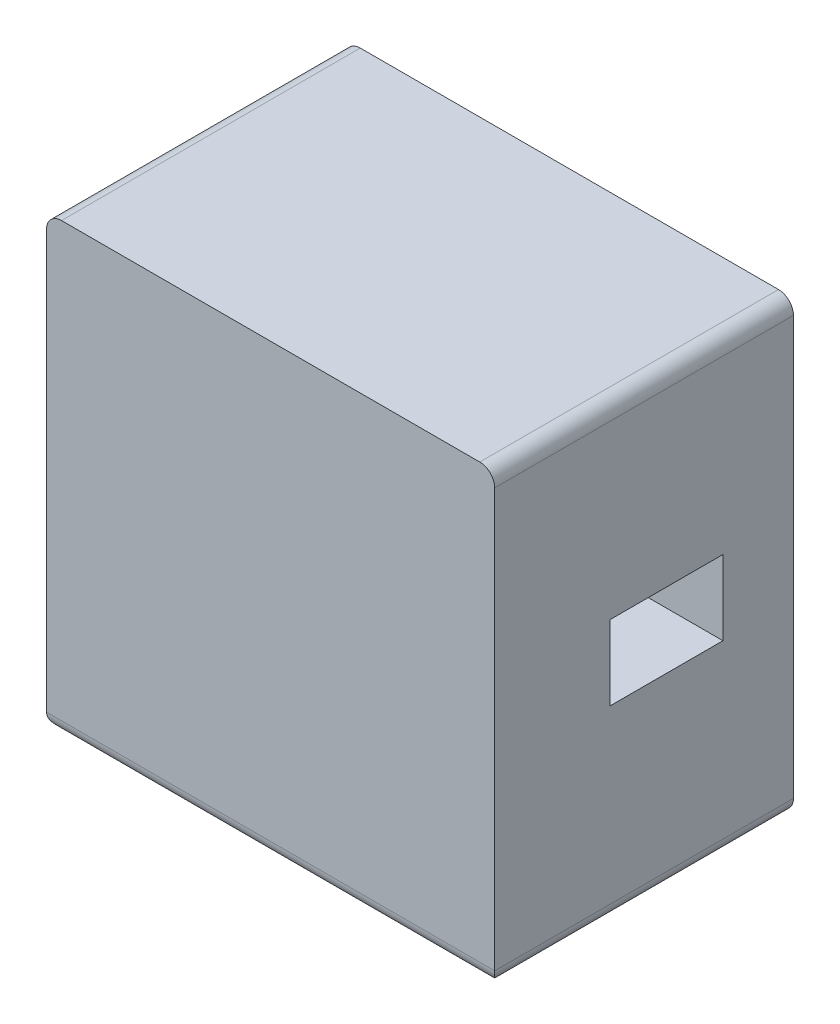
from build123d import *

# Parameters (mm, degrees)
SKETCH_1_W          = 300
SKETCH_1_H          = 300
EXTRUDE_3_DEPTH     = 200
SKETCH_5_R          = 32.35
CUT_EXTRUDE_3_DEPTH = 62
SKETCH_6_R          = 38.24
CUT_EXTRUDE_4_DEPTH = 23.7
CUT_EXTRUDE_5_REACH = 392.512
SKETCH_8_W          = 75.602160899
SKETCH_8_H          = 50
SKETCH_10_R         = 1.35
CUT_EXTRUDE_7_DEPTH = 5
FILLET_1_R          = 10


with BuildPart() as part:
    # 草图1 → 凸台-拉伸3 (new body)
    with BuildSketch(Plane.XY):
        Rectangle(SKETCH_1_W, SKETCH_1_H)
    extrude(amount=EXTRUDE_3_DEPTH)

    # 草图5 → 切除-拉伸3 (cut)
    with BuildSketch(Plane(origin=(0, 0, 0), x_dir=(-1, 0, 0), z_dir=(0, 0, -1))):
        Circle(SKETCH_5_R)
    extrude(amount=-CUT_EXTRUDE_3_DEPTH, mode=Mode.SUBTRACT)

    # 草图6 → 切除-拉伸4 (cut)
    with BuildSketch(Plane(origin=(0, 0, 0), x_dir=(-1, 0, 0), z_dir=(0, 0, -1))):
        Circle(SKETCH_6_R)
    extrude(amount=-CUT_EXTRUDE_4_DEPTH, mode=Mode.SUBTRACT)

    # 草图8 → 切除-拉伸5 (cut, up to next)
    with BuildSketch(Plane.ZY.offset(150), mode=Mode.PRIVATE) as cut_extrude_5_sk1:
        with Locations((85.011080449, 0)):
            Rectangle(SKETCH_8_W, SKETCH_8_H)
    cut_extrude_5_tool1 = extrude(cut_extrude_5_sk1.sketch, amount=-CUT_EXTRUDE_5_REACH, mode=Mode.PRIVATE) & part.part
    add(cut_extrude_5_tool1.solids().sort_by_distance((-150, 0, 85.01108))[0], mode=Mode.SUBTRACT)

    # 草图10 → 切除-拉伸7 (cut)
    with BuildSketch(Plane(origin=(0, 0, 23.7), x_dir=(-1, 0, 0), z_dir=(0, 0, -1))):
        with Locations((0, -35.295)):
            Circle(SKETCH_10_R)
        with Locations((-14.355769817, -32.243586927)):
            Circle(SKETCH_10_R)
        with Locations((-26.229296615, -23.616964751)):
            Circle(SKETCH_10_R)
        with Locations((-33.567539743, -10.906754816)):
            Circle(SKETCH_10_R)
        with Locations((-35.101650297, 3.689332111)):
            Circle(SKETCH_10_R)
        with Locations((-30.566366627, 17.6475)):
            Circle(SKETCH_10_R)
        with Locations((-20.74588048, 28.554254816)):
            Circle(SKETCH_10_R)
        with Locations((-7.338243127, 34.523719568)):
            Circle(SKETCH_10_R)
        with Locations((7.338243127, 34.523719568)):
            Circle(SKETCH_10_R)
        with Locations((20.74588048, 28.554254816)):
            Circle(SKETCH_10_R)
        with Locations((30.566366627, 17.6475)):
            Circle(SKETCH_10_R)
        with Locations((35.101650297, 3.689332111)):
            Circle(SKETCH_10_R)
        with Locations((33.567539743, -10.906754816)):
            Circle(SKETCH_10_R)
        with Locations((26.229296615, -23.616964751)):
            Circle(SKETCH_10_R)
        with Locations((14.355769817, -32.243586927)):
            Circle(SKETCH_10_R)
    extrude(amount=-CUT_EXTRUDE_7_DEPTH, mode=Mode.SUBTRACT)

    # 圆角1
    fillet_1_edges = [part.edges().sort_by_distance(p)[0] for p in [
        (0, -150, 200),
        (150, -150, 100),
        (-150, -150, 100),
        (-150, 150, 100),
        (150, 150, 100),
    ]]
    fillet(fillet_1_edges, radius=FILLET_1_R)


solid = part.part
